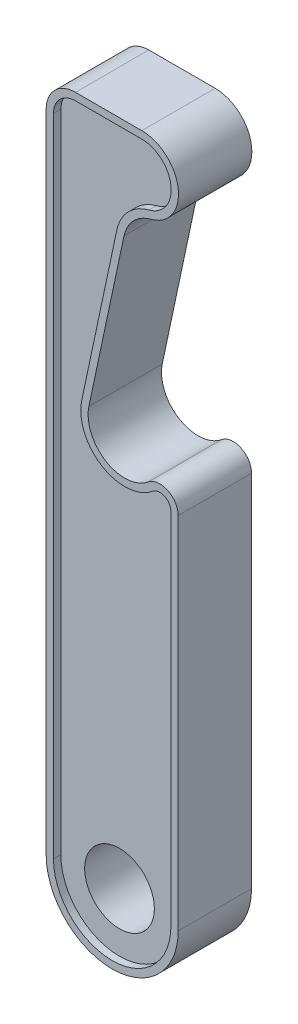
from build123d import *

# Parameters (mm, degrees)
SKETCH2_R           = 4.75
BOSS_EXTRUDE2_DEPTH = 4.5
BOSS_EXTRUDE3_START = 5.5
BOSS_EXTRUDE3_DEPTH = 10


with BuildPart() as part:
    # Sketch2 → Boss-Extrude2 (new, symmetric)
    with BuildSketch(Plane(origin=(0, 0, 0), x_dir=(0, 1, 0), z_dir=(0, 0, 1))):
        with BuildLine():
            Line((0, 8), (88, 8))
            ThreePointArc((88, 8), (90.121320344, 7.121320344), (91, 5))
            Line((91, 5), (91, -4.038605995))
            ThreePointArc((91, -4.038605995), (87.49610936, -8.007721199), (83.123062249, -5.023163597))
            ThreePointArc((83.123062249, -5.023163597), (81.466210794, -2.174908223), (78.555125766, -0.631114396))
            Line((78.555125766, -0.631114396), (56.055125766, 4.151408242))
            ThreePointArc((56.055125766, 4.151408242), (49.674974507, 1.389866291), (50.185796102, -5.543495472))
            ThreePointArc((50.185796102, -5.543495472), (50.387673623, -7.138452508), (49.030331222, -8))
            Line((49.030331222, -8), (0, -8))
            ThreePointArc((0, -8), (-8, 0), (0, 8))
        make_face()
        with Locations(Location((0, 0, 0), (0, 0, 270))):
            Circle(SKETCH2_R, mode=Mode.SUBTRACT)
    extrude(amount=BOSS_EXTRUDE2_DEPTH, both=True)

    # Sketch2<4> → Boss-Extrude3 (add)
    with BuildSketch(Plane(origin=(0, 0, 0), x_dir=(0, 1, 0), z_dir=(0, 0, 1)).offset(BOSS_EXTRUDE3_START)):
        with BuildLine():
            ThreePointArc((78.347214076, -1.609261996), (80.773118265, -2.895756853), (82.153827811, -5.269302997))
            ThreePointArc((82.153827811, -5.269302997), (87.6201367, -9), (92, -4.038605995))
            Line((92, -4.038605995), (92, 5))
            ThreePointArc((92, 5), (90.828427125, 7.828427125), (88, 9))
            Line((88, 9), (0, 9))
            ThreePointArc((0, 9), (-9, 0), (0, -9))
            Line((0, -9), (49.030331222, -9))
            ThreePointArc((49.030331222, -9), (51.292568558, -7.564087513), (50.956106022, -4.905825787))
            ThreePointArc((50.956106022, -4.905825787), (50.53042136, 0.871975682), (55.847214076, 3.173260641))
            Line((55.847214076, 3.173260641), (78.347214076, -1.609261996))
        make_face()
        with BuildLine():
            ThreePointArc((0, 8), (-8, 0), (0, -8))
            Line((0, -8), (49.030331222, -8))
            ThreePointArc((49.030331222, -8), (50.387673623, -7.138452508), (50.185796102, -5.543495472))
            ThreePointArc((50.185796102, -5.543495472), (49.674974507, 1.389866291), (56.055125766, 4.151408242))
            Line((56.055125766, 4.151408242), (78.555125766, -0.631114396))
            ThreePointArc((78.555125766, -0.631114396), (81.466210794, -2.174908223), (83.123062249, -5.023163597))
            ThreePointArc((83.123062249, -5.023163597), (87.49610936, -8.007721199), (91, -4.038605995))
            Line((91, -4.038605995), (91, 5))
            ThreePointArc((91, 5), (90.121320344, 7.121320344), (88, 8))
            Line((88, 8), (0, 8))
        make_face(mode=Mode.SUBTRACT)
    extrude(amount=-BOSS_EXTRUDE3_DEPTH)


solid = part.part
